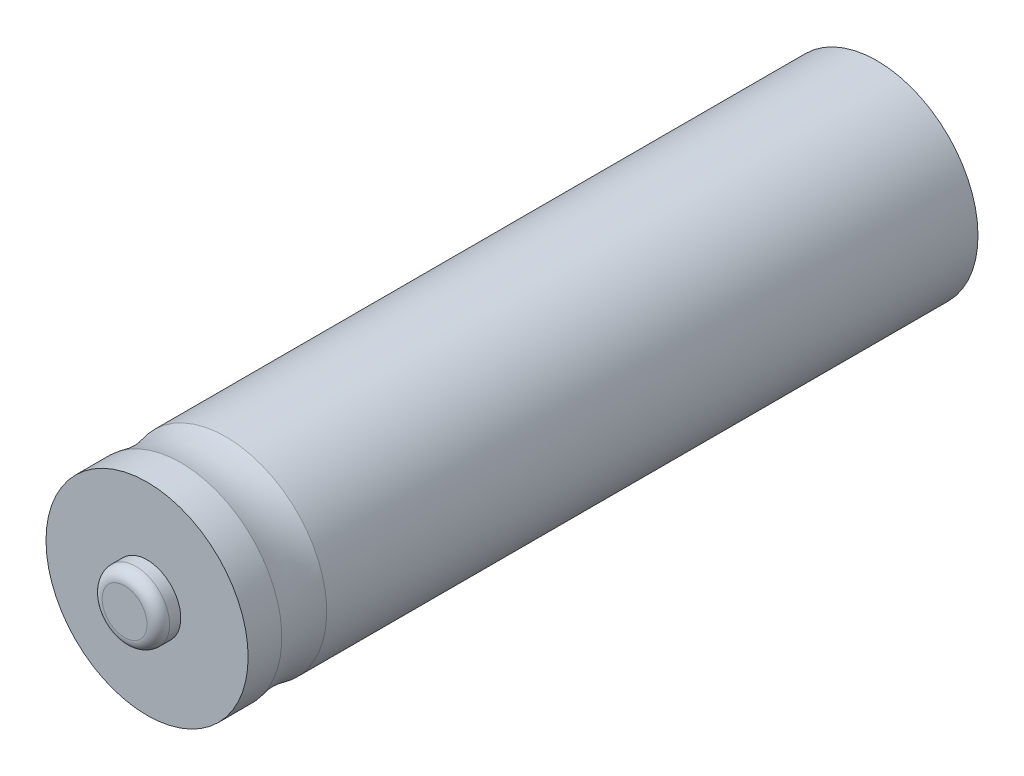
from build123d import *

# Parameters (mm, degrees)
ESBO_O1_R                = 9
RESSALTO_EXTRUS_O1_DEPTH = 32.5
ESBO_O2_R                = 3
RESSALTO_EXTRUS_O2_DEPTH = 2
FILETE1_R                = 1
ESBO_O4_R                = 5.5
RESSALTO_EXTRUS_O3_DEPTH = 0.4


with BuildPart() as part:
    # Esboço1 → Ressalto-extrusão1 (new, symmetric)
    with BuildSketch(Plane.XY):
        Circle(ESBO_O1_R)
    extrude(amount=RESSALTO_EXTRUS_O1_DEPTH, both=True)

    # Esboço2 → Ressalto-extrusão2 (add)
    with BuildSketch(Plane.XY.offset(32.5)):
        Circle(ESBO_O2_R)
    extrude(amount=RESSALTO_EXTRUS_O2_DEPTH)

    # Filete1
    filete1_edges = [part.edges().sort_by_distance(p)[0] for p in [
        (-3, 0, 34.5),
    ]]
    fillet(filete1_edges, radius=FILETE1_R)

    # Esboço3 → Corte-Revolução1 (revolve, cut)
    with BuildSketch(Plane(origin=(0, 0, 0), x_dir=(0, 0, -1), z_dir=(1, 0, 0)), mode=Mode.PRIVATE) as corte_revolu_o1_sk:
        with BuildLine():
            Line((-29.5, 9), (-25.5, 9))
            ThreePointArc((-25.5, 9), (-27.5, 8.73940243), (-29.5, 9))
        make_face()
    revolve(corte_revolu_o1_sk.sketch.rotate(Axis((0, 0, 34.5), (0, 0, 1)), 90), axis=Axis((0, 0, 34.5), (0, 0, 1)), mode=Mode.SUBTRACT)

    # Esboço4 → Ressalto-extrusão3 (add)
    with BuildSketch(Plane(origin=(0, 0, -32.5), x_dir=(-1, 0, 0), z_dir=(0, 0, -1))):
        Circle(ESBO_O4_R)
    extrude(amount=RESSALTO_EXTRUS_O3_DEPTH)


solid = part.part
